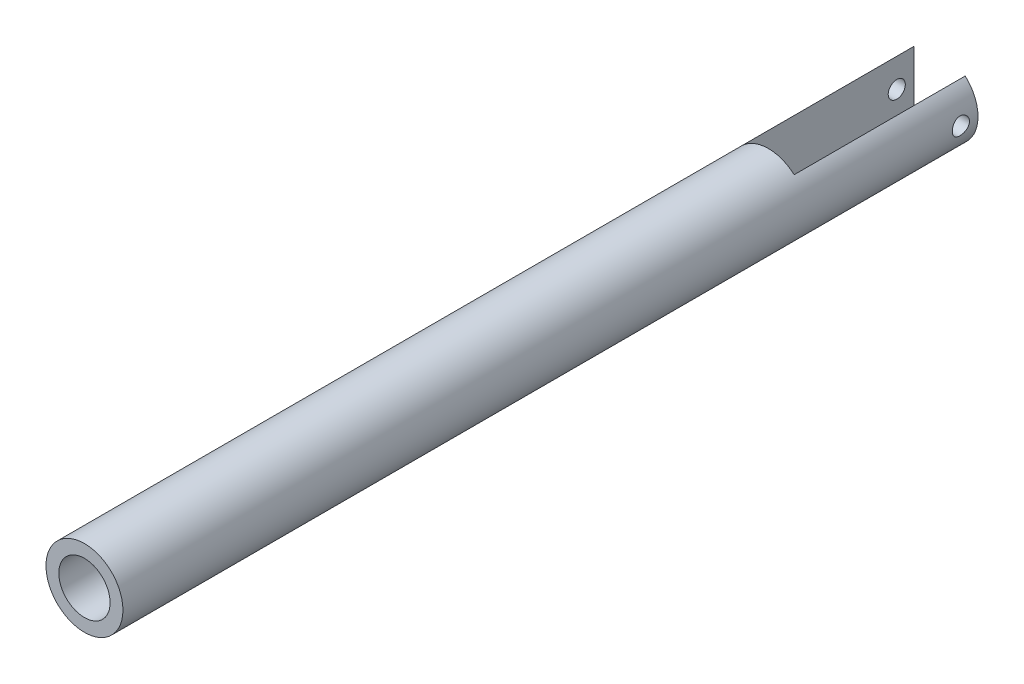
from build123d import *
from build123d.topology import SkipClean

# Parameters (mm, degrees)
SKETCH2_R               = 4.5
SKETCH2_R_2             = 3
BOSS_EXTRUDE1_DEPTH     = 80
BOSS_EXTRUDE2_START     = 20
BOSS_EXTRUDE2_DEPTH     = 20
CUT_EXTRUDE1_DEPTH      = 81.476704704
CUT_EXTRUDE1_DEPTH_BACK = 81.476704704
SKETCH4_R               = 1
BOSS_EXTRUDE3_START     = 2
SKETCH7_R               = 3
SKETCH7_R_2             = 1
BOSS_EXTRUDE3_DEPTH     = 2
SKETCH10_R              = 3
SKETCH10_R_2            = 1
BOSS_EXTRUDE4_DEPTH     = 2


with BuildPart() as part:
    # Sketch2 → Boss-Extrude1 (new body)
    with BuildSketch(Plane.XY):
        Circle(SKETCH2_R)
        Circle(SKETCH2_R_2, mode=Mode.SUBTRACT)
    extrude(amount=BOSS_EXTRUDE1_DEPTH)

    # Sketch3 → Boss-Extrude2 (add)
    with SkipClean():  # the faces are left unmerged after this step: merging them gives an invalid solid
        with BuildSketch(Plane(origin=(0, 0, 0), x_dir=(-1, 0, 0), z_dir=(0, 0, -1)).offset(BOSS_EXTRUDE2_START)):
            with BuildLine():
                Line((3, 3.354101966), (3, -3.354101966))
                ThreePointArc((3, -3.354101966), (4.5, 0), (3, 3.354101966))
            make_face()
            with BuildLine():
                Line((-3, 3.354101966), (-3, -3.354101966))
                ThreePointArc((-3, -3.354101966), (-4.5, 0), (-3, 3.354101966))
            make_face()
        extrude(amount=-BOSS_EXTRUDE2_DEPTH)

    # Sketch4 → Cut-Extrude1 (cut, two sides: drawn at the far end of the back side and taken through both)
    with SkipClean():  # the faces are left unmerged after this step: merging them gives an invalid solid
        with BuildSketch(Plane.ZY.offset(-3).offset(-CUT_EXTRUDE1_DEPTH_BACK)):
            with Locations((-18, 0)):
                Circle(SKETCH4_R)
        extrude(amount=CUT_EXTRUDE1_DEPTH + CUT_EXTRUDE1_DEPTH_BACK, mode=Mode.SUBTRACT)

    # Sketch7 → Boss-Extrude3 (add)
    with SkipClean():  # the faces are left unmerged after this step: merging them gives an invalid solid
        with BuildSketch(Plane(origin=(0, 0, 30), x_dir=(-1, 0, 0), z_dir=(0, 0, -1)).offset(BOSS_EXTRUDE3_START)):
            Circle(SKETCH7_R)
            Circle(SKETCH7_R_2, mode=Mode.SUBTRACT)
        extrude(amount=-BOSS_EXTRUDE3_DEPTH)

    # Sketch10 → Boss-Extrude4 (add)
    with SkipClean():  # the faces are left unmerged after this step: merging them gives an invalid solid
        with BuildSketch(Plane(origin=(0, 0, 60), x_dir=(-1, 0, 0), z_dir=(0, 0, -1))):
            Circle(SKETCH10_R)
            Circle(SKETCH10_R_2, mode=Mode.SUBTRACT)
        extrude(amount=-BOSS_EXTRUDE4_DEPTH)


solid = part.part
